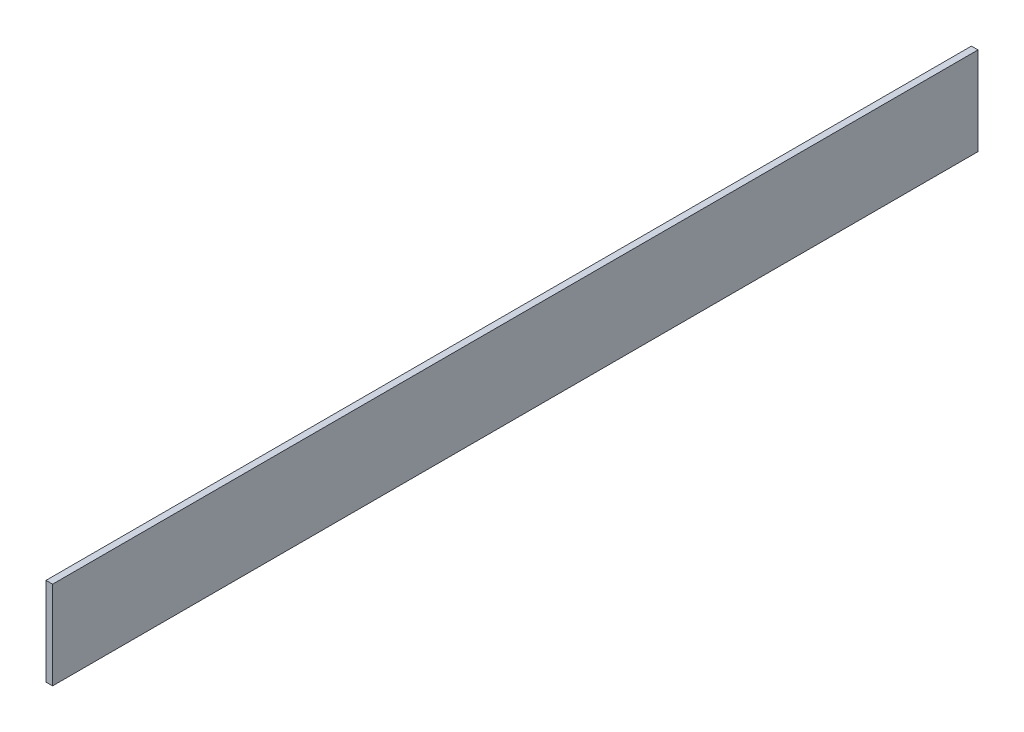
from build123d import *

# Parameters (mm, degrees)
SKETCH1_W           = 420
SKETCH1_H           = 40
BOSS_EXTRUDE1_DEPTH = 3


with BuildPart() as part:
    # Sketch1 → Boss-Extrude1 (new body)
    with BuildSketch(Plane(origin=(0, 0, 0), x_dir=(0, 0, -1), z_dir=(1, 0, 0))):
        with Locations((210, 20)):
            Rectangle(SKETCH1_W, SKETCH1_H)
    extrude(amount=BOSS_EXTRUDE1_DEPTH)


solid = part.part
